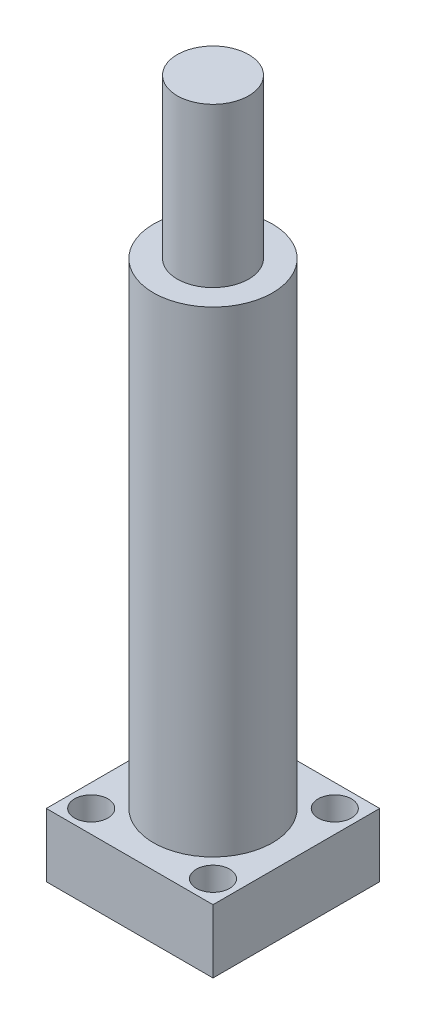
from build123d import *

# Parameters (mm, degrees)
SKETCH_1_R      = 7.5
EXTRUDE_1_DEPTH = 68
SKETCH_2_W      = 21
SKETCH_2_H      = 21
SKETCH_2_R      = 2.1
EXTRUDE_2_DEPTH = 8
SKETCH_3_R      = 4.5
EXTRUDE_3_DEPTH = 20


with BuildPart() as part:
    # 草图1 → 凸台-拉伸1 (new body)
    with BuildSketch(Plane(origin=(0, 0, 0), x_dir=(1, 0, 0), z_dir=(0, 1, 0))):
        with Locations(Location((0, 0, 0), (0, 0, 270))):
            Circle(SKETCH_1_R)
    extrude(amount=EXTRUDE_1_DEPTH)

    # 草图2 → 凸台-拉伸2 (add)
    with BuildSketch(Plane.XZ):
        Rectangle(SKETCH_2_W, SKETCH_2_H)
        with Locations(Location((-7.671572875, 7.671572875, 0), (0, 0, 270))):
            Circle(SKETCH_2_R, mode=Mode.SUBTRACT)
        with Locations(Location((7.671572875, -7.671572875, 0), (0, 0, 270))):
            Circle(SKETCH_2_R, mode=Mode.SUBTRACT)
        with Locations(Location((7.671572875, 7.671572875, 0), (0, 0, 270))):
            Circle(SKETCH_2_R, mode=Mode.SUBTRACT)
        with Locations(Location((-7.671572875, -7.671572875, 0), (0, 0, 270))):
            Circle(SKETCH_2_R, mode=Mode.SUBTRACT)
    extrude(amount=-EXTRUDE_2_DEPTH)

    # 草图3 → 凸台-拉伸3 (add)
    with BuildSketch(Plane(origin=(0, 68, 0), x_dir=(1, 0, 0), z_dir=(0, 1, 0))):
        with Locations(Location((0, 0, 0), (0, 0, 270))):
            Circle(SKETCH_3_R)
    extrude(amount=EXTRUDE_3_DEPTH)


solid = part.part
